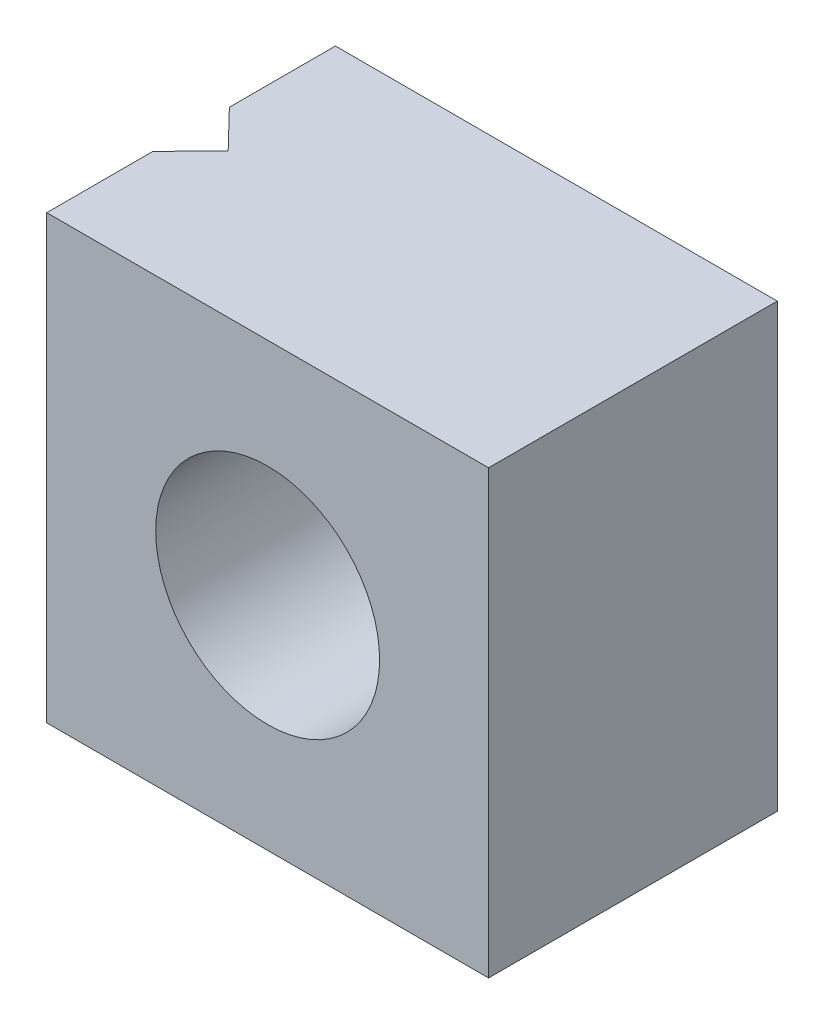
from build123d import *

# Parameters (mm, degrees)
SKETCH1_W               = 19.05
SKETCH1_H               = 19.05
SKETCH1_R               = 4.826
BOSS_EXTRUDE1_DEPTH     = 12.446
CUT_EXTRUDE1_DEPTH      = 30.676723471
CUT_EXTRUDE1_DEPTH_BACK = 30.676723471


with BuildPart() as part:
    # Sketch1 → Boss-Extrude1 (new body)
    with BuildSketch(Plane.XY):
        with Locations((9.525, -9.525)):
            Rectangle(SKETCH1_W, SKETCH1_H)
        with Locations((9.525, -9.525)):
            Circle(SKETCH1_R, mode=Mode.SUBTRACT)
    extrude(amount=-BOSS_EXTRUDE1_DEPTH)

    # Sketch2 → Cut-Extrude1 (cut, two sides: drawn at the far end of the back side and taken through both)
    with BuildSketch(Plane(origin=(0, 0, 0), x_dir=(1, 0, 0), z_dir=(0, 1, 0)).offset(-CUT_EXTRUDE1_DEPTH_BACK)):
        Polygon((-35.652150586, -32.211964891), (0, 4.572), (1.6002, 6.223), (0, 7.874), (-35.652150586, 44.657964891), (-138.104791636, 44.657964891), (-138.104791636, -32.211964891), align=None)
    extrude(amount=CUT_EXTRUDE1_DEPTH + CUT_EXTRUDE1_DEPTH_BACK, mode=Mode.SUBTRACT)


solid = part.part
